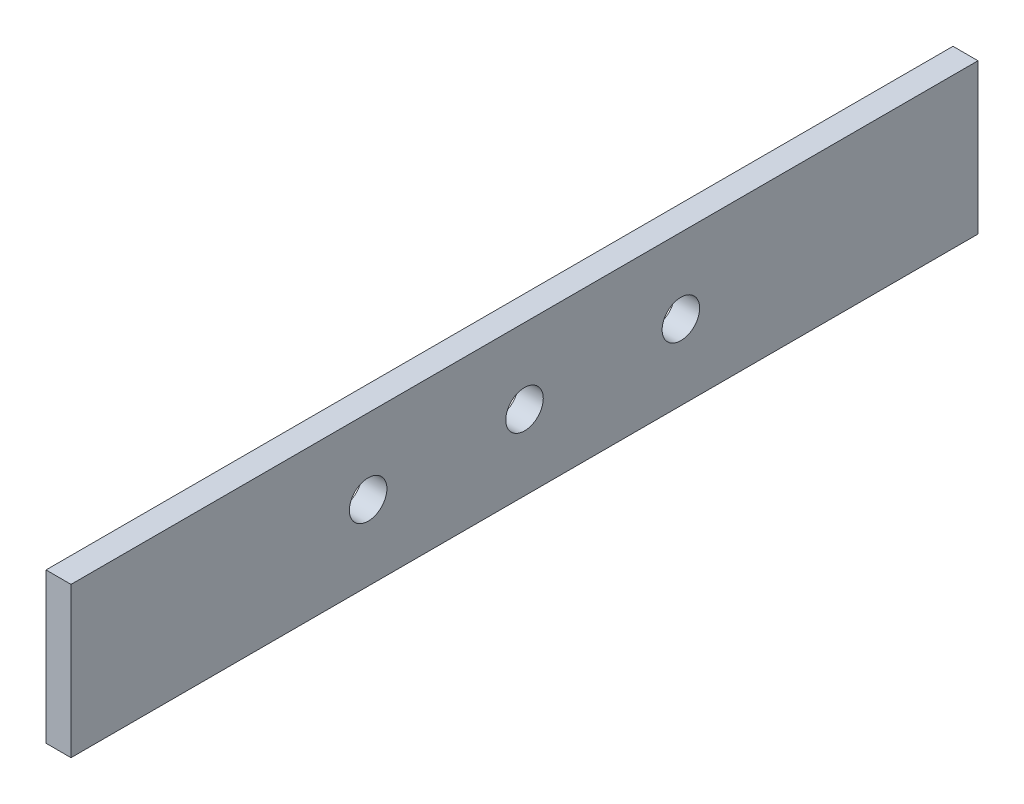
from build123d import *

# Parameters (mm, degrees)
SKETCH1_W           = 72.5
SKETCH1_H           = 12
BOSS_EXTRUDE1_DEPTH = 2
SKETCH3_R           = 1.5
CUT_EXTRUDE1_DEPTH  = 2


with BuildPart() as part:
    # Sketch1 → Boss-Extrude1 (new body)
    with BuildSketch(Plane(origin=(0, 0, 0), x_dir=(0, 0, -1), z_dir=(1, 0, 0))):
        with Locations((12.502432277, 6)):
            Rectangle(SKETCH1_W, SKETCH1_H)
    extrude(amount=BOSS_EXTRUDE1_DEPTH)

    # Sketch3 → Cut-Extrude1 (cut)
    with BuildSketch(Plane(origin=(2, 0, 0), x_dir=(0, 0, -1), z_dir=(1, 0, 0))):
        with Locations((12.502432277, 6)):
            Circle(SKETCH3_R)
        with Locations((0.002432277, 6)):
            Circle(SKETCH3_R)
        with Locations((25.002432277, 6)):
            Circle(SKETCH3_R)
    extrude(amount=-CUT_EXTRUDE1_DEPTH, mode=Mode.SUBTRACT)


solid = part.part
